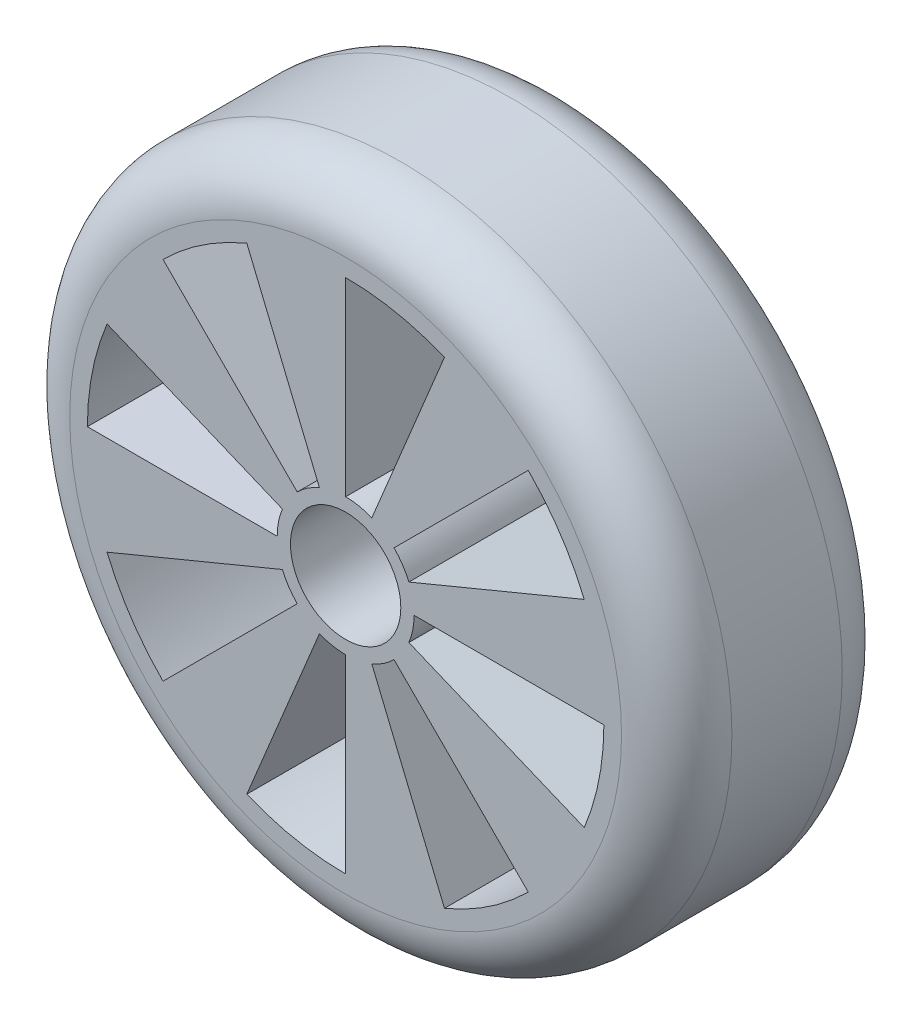
from build123d import *

# Parameters (mm, degrees)
SKETCH1_R               = 150
BOSS_EXTRUDE1_DEPTH     = 100
FILLET1_R               = 25
CUT_EXTRUDE1_DEPTH      = 300
CUT_EXTRUDE1_DEPTH_BACK = 300
CUT_EXTRUDE2_DEPTH      = 300
CUT_EXTRUDE2_DEPTH_BACK = 300
SKETCH5_R               = 25


with BuildPart() as part:
    # Sketch1 → Boss-Extrude1 (new body)
    with BuildSketch(Plane.XY):
        Circle(SKETCH1_R)
    extrude(amount=BOSS_EXTRUDE1_DEPTH)

    # Fillet1
    fillet1_edges = [part.edges().sort_by_distance(p)[0] for p in [
        (-150, 0, 0),
        (-150, 0, 100),
    ]]
    fillet(fillet1_edges, radius=FILLET1_R)

    # Sketch4 → Cut-Extrude1 (cut, two sides: drawn at the far end of the back side and taken through both)
    with BuildSketch(Plane.XY.offset(-CUT_EXTRUDE1_DEPTH_BACK)):
        with BuildLine():
            Line((82.731493399, 82.731493399), (21.920310217, 21.920310217))
            ThreePointArc((21.920310217, 21.920310217), (25.775557981, 17.222677224), (28.640265508, 11.863186403))
            Line((28.640265508, 11.863186403), (108.093905304, 44.773961587))
            ThreePointArc((108.093905304, 44.773961587), (97.281944639, 65.001717263), (82.731493399, 82.731493399))
        make_face()
        with BuildLine():
            Line((0, 117), (0, 31))
            ThreePointArc((0, 31), (6.047799982, 30.404343693), (11.863186403, 28.640265508))
            Line((11.863186403, 28.640265508), (44.773961587, 108.093905304))
            ThreePointArc((44.773961587, 108.093905304), (22.825567676, 114.751877807), (0, 117))
        make_face()
        with BuildLine():
            Line((-82.731493399, 82.731493399), (-21.920310217, 21.920310217))
            ThreePointArc((-21.920310217, 21.920310217), (-17.222677224, 25.775557981), (-11.863186403, 28.640265508))
            Line((-11.863186403, 28.640265508), (-44.773961587, 108.093905304))
            ThreePointArc((-44.773961587, 108.093905304), (-65.001717263, 97.281944639), (-82.731493399, 82.731493399))
        make_face()
        with BuildLine():
            Line((-117, 0), (-31, 0))
            ThreePointArc((-31, 0), (-30.404343693, 6.047799983), (-28.640265508, 11.863186403))
            Line((-28.640265508, 11.863186403), (-108.093905304, 44.773961587))
            ThreePointArc((-108.093905304, 44.773961587), (-114.751877807, 22.825567676), (-117, 0))
        make_face()
        with BuildLine():
            Line((-82.731493399, -82.731493399), (-21.920310217, -21.920310217))
            ThreePointArc((-21.920310217, -21.920310217), (-25.775557981, -17.222677224), (-28.640265508, -11.863186403))
            Line((-28.640265508, -11.863186403), (-108.093905304, -44.773961587))
            ThreePointArc((-108.093905304, -44.773961587), (-97.281944639, -65.001717263), (-82.731493399, -82.731493399))
        make_face()
        with BuildLine():
            Line((0, -117), (0, -31))
            ThreePointArc((0, -31), (-6.047799983, -30.404343693), (-11.863186403, -28.640265508))
            Line((-11.863186403, -28.640265508), (-44.773961587, -108.093905304))
            ThreePointArc((-44.773961587, -108.093905304), (-22.825567676, -114.751877807), (0, -117))
        make_face()
        with BuildLine():
            Line((82.731493399, -82.731493399), (21.920310217, -21.920310217))
            ThreePointArc((21.920310217, -21.920310217), (17.222677224, -25.775557981), (11.863186403, -28.640265508))
            Line((11.863186403, -28.640265508), (44.773961587, -108.093905304))
            ThreePointArc((44.773961587, -108.093905304), (65.001717263, -97.281944639), (82.731493399, -82.731493399))
        make_face()
        with BuildLine():
            Line((117, 0), (31, 0))
            ThreePointArc((31, 0), (30.404343693, -6.047799983), (28.640265508, -11.863186403))
            Line((28.640265508, -11.863186403), (108.093905304, -44.773961587))
            ThreePointArc((108.093905304, -44.773961587), (114.751877807, -22.825567676), (117, 0))
        make_face()
    extrude(amount=CUT_EXTRUDE1_DEPTH + CUT_EXTRUDE1_DEPTH_BACK, mode=Mode.SUBTRACT)

    # Sketch5 → Cut-Extrude2 (cut, two sides: drawn at the far end of the back side and taken through both)
    with BuildSketch(Plane.XY.offset(-CUT_EXTRUDE2_DEPTH_BACK)):
        Circle(SKETCH5_R)
    extrude(amount=CUT_EXTRUDE2_DEPTH + CUT_EXTRUDE2_DEPTH_BACK, mode=Mode.SUBTRACT)


solid = part.part
